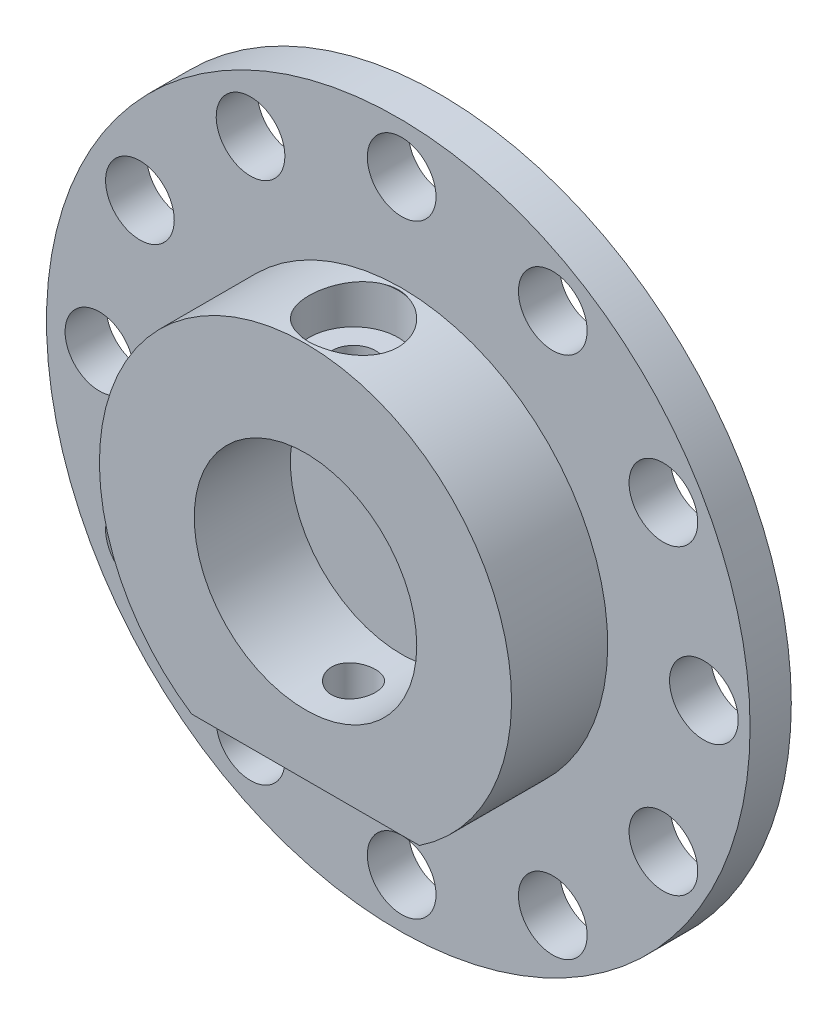
from build123d import *

# Parameters (mm, degrees)
SKETCH1_R           = 25.608746635
BOSS_EXTRUDE1_DEPTH = 3
SKETCH2_R           = 8.1
BOSS_EXTRUDE2_DEPTH = 7
SKETCH7_R           = 2.5
CUT_EXTRUDE1_DEPTH  = 10
CIRPATTERN1_COUNT   = 12


with BuildPart() as part:
    # Sketch1 → Boss-Extrude1 (new body)
    with BuildSketch(Plane.XY):
        with Locations((-0.244898521, 0)):
            Circle(SKETCH1_R)
    extrude(amount=BOSS_EXTRUDE1_DEPTH)

    # Sketch2 → Boss-Extrude2 (add)
    with BuildSketch(Plane.XY.offset(3)):
        with BuildLine():
            Line((8.291561976, -12.5), (-8.291561976, -12.5))
            ThreePointArc((-8.291561976, -12.5), (0, 15), (8.291561976, -12.5))
        make_face()
        Circle(SKETCH2_R, mode=Mode.SUBTRACT)
    extrude(amount=BOSS_EXTRUDE2_DEPTH)

    # Sketch4 → CBORE for M3 SHCS1 (revolve, cut)
    with BuildSketch(Plane(origin=(0, 15, 6.5), x_dir=(0, 0, 1), z_dir=(1, 0, 0))):
        Polygon((0, 0), (0, 40.608746635), (1.6, 40.608746635), (1.6, 3), (3.25, 3), (3.25, 0.025), (3.275, 0), align=None)
    revolve(axis=Axis((0, 21.35, 6.5), (0, -1, 0)), mode=Mode.SUBTRACT)

    # Sketch7 → Cut-Extrude1 (cut)
    with BuildSketch(Plane(origin=(0, 0, 0), x_dir=(-1, 0, 0), z_dir=(0, 0, -1))):
        with Locations((0, 22)):
            Circle(SKETCH7_R)
    cut_extrude1 = extrude(amount=-CUT_EXTRUDE1_DEPTH, mode=Mode.SUBTRACT)

    # CirPattern1: Cut-Extrude1 ×12 about axis
    cirpattern1_axis = Axis((0, 0, 0), (0, 0, 1))
    for i in range(1, CIRPATTERN1_COUNT):
        add(cut_extrude1.rotate(cirpattern1_axis, i * 360 / CIRPATTERN1_COUNT), mode=Mode.SUBTRACT)


solid = part.part
